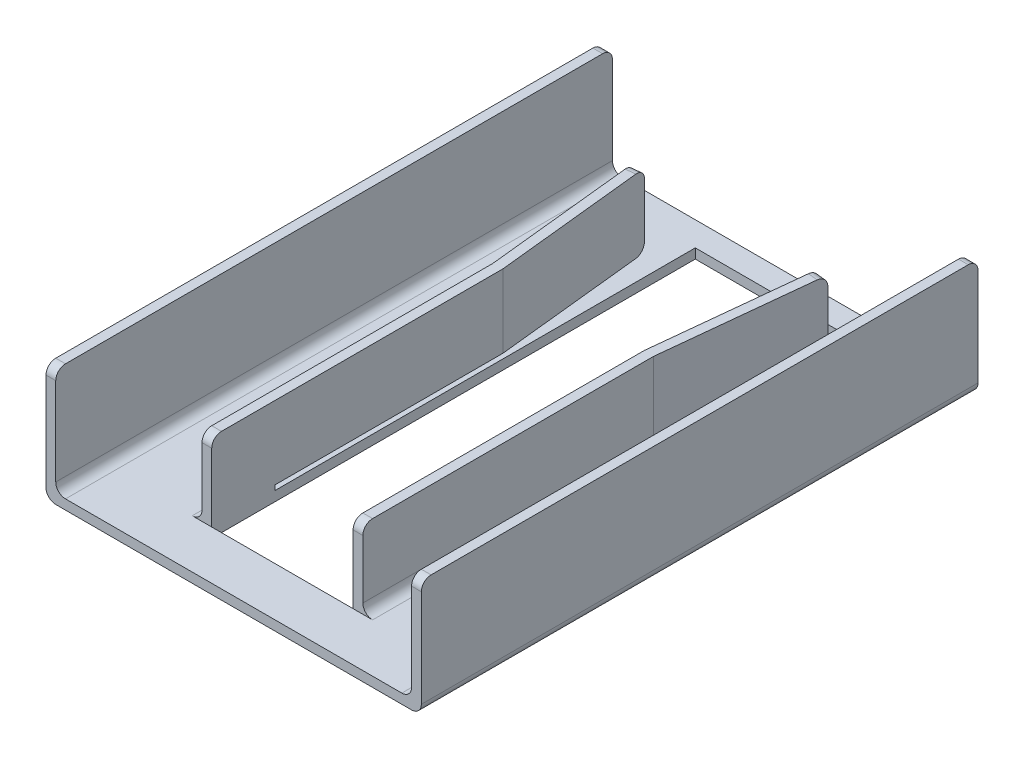
from build123d import *

# Parameters (mm, degrees)
BOSS_EXTRUDE1_DEPTH = 5.71
SKETCH3_W           = 1.45
SKETCH3_H           = 4.96
CUT_EXTRUDE1_DEPTH  = 7.125334685
SKETCH4_W           = 0.1
SKETCH4_H           = 0.647523409
BOSS_EXTRUDE2_DEPTH = 0.05
BOSS_EXTRUDE3_START = 0.05
SKETCH4_3_W         = 0.1
SKETCH4_3_H         = 0.647523409
BOSS_EXTRUDE3_DEPTH = 0.75
FILLET1_R           = 0.1


with BuildPart() as part:
    # Sketch2 → Boss-Extrude1 (new body)
    with BuildSketch(Plane.XY):
        Polygon((1.925, -0.6), (1.925, 0.6), (1.825, 0.6), (1.825, -0.5), (-1.825, -0.5), (-1.825, 0.6), (-1.925, 0.6), (-1.925, -0.6), align=None)
    extrude(amount=-BOSS_EXTRUDE1_DEPTH)

    # Sketch3 → Cut-Extrude1 (cut, through all)
    with BuildSketch(Plane(origin=(0, -0.5, 0), x_dir=(1, 0, 0), z_dir=(0, 1, 0))):
        with Locations((0, 2.98)):
            Rectangle(SKETCH3_W, SKETCH3_H)
    extrude(amount=-CUT_EXTRUDE1_DEPTH, mode=Mode.SUBTRACT)

    # Sketch4 → Boss-Extrude2 (add)
    with BuildSketch(Plane(origin=(0, -0.5, 0), x_dir=(1, 0, 0), z_dir=(0, 1, 0))):
        with Locations((-0.775, 0.823761705)):
            Rectangle(SKETCH4_W, SKETCH4_H)
        with Locations((0.775, 0.823761705)):
            Rectangle(SKETCH4_W, SKETCH4_H)
    extrude(amount=BOSS_EXTRUDE2_DEPTH)

    # Sketch4<3> → Boss-Extrude3 (add)
    with BuildSketch(Plane(origin=(0, -0.5, 0), x_dir=(1, 0, 0), z_dir=(0, 1, 0)).offset(BOSS_EXTRUDE3_START)):
        with Locations((-0.775, 0.823761705)):
            Rectangle(SKETCH4_3_W, SKETCH4_3_H)
        Polygon((-0.725, 1.147523409), (-0.725, 3.487072701), (-0.895576533, 5.11), (-0.995028722, 5.099547154), (-0.825, 3.481831923), (-0.825, 1.147523409), align=None)
        with Locations((0.775, 0.823761705)):
            Rectangle(SKETCH4_3_W, SKETCH4_3_H)
        Polygon((0.725, 3.487072701), (0.725, 1.147523409), (0.825, 1.147523409), (0.825, 3.481831923), (0.995028722, 5.099547154), (0.895576533, 5.11), align=None)
    extrude(amount=BOSS_EXTRUDE3_DEPTH)

    # Fillet1
    fillet1_edges = [part.edges().sort_by_distance(p)[0] for p in [
        (-1.875, 0.6, -5.71),
        (1.875, 0.6, -5.71),
        (0.945302627, -0.45, -5.104773577),
        (0.945302627, 0.3, -5.104773577),
        (-0.945302627, -0.45, -5.104773577),
        (-0.945302627, 0.3, -5.104773577),
        (-0.775, 0.3, -0.5),
        (0.775, 0.3, -0.5),
        (1.875, 0.6, 0),
        (-1.875, 0.6, 0),
        (-0.825, -0.5, -0.823761705),
        (0.825, -0.5, -0.823761705),
        (1.825, -0.5, -2.855),
        (-1.825, -0.5, -2.855),
        (1.925, -0.6, -2.855),
        (-1.925, -0.6, -2.855),
    ]]
    fillet(fillet1_edges, radius=FILLET1_R)


solid = part.part
